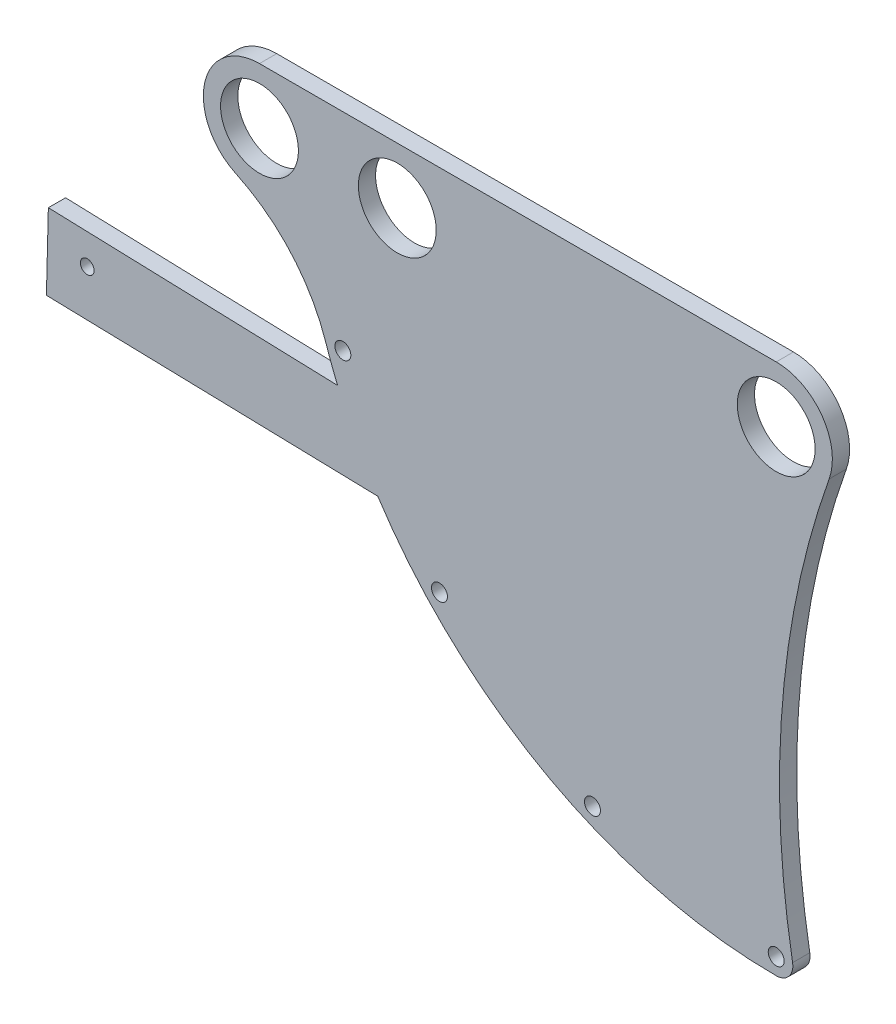
from build123d import *

# Parameters (mm, degrees)
SKETCH1_W           = 342.9
SKETCH1_H           = 225.424999902
SKETCH1_R           = 14.351
SKETCH1_R_2         = 2.9464
BOSS_EXTRUDE1_DEPTH = 6.35
SKETCH3_W           = 82.55
SKETCH3_H           = 25.4
SKETCH3_W_2         = 107.95
BOSS_EXTRUDE2_DEPTH = 6.35
SKETCH2_W           = 349.25
SKETCH2_H           = 250.824999902
CUT_EXTRUDE1_DEPTH  = 425.892825399
SKETCH4_R           = 2.54
BOSS_EXTRUDE3_DEPTH = 6.35


with BuildPart() as part:
    # Sketch1 → Boss-Extrude1 (new body)
    with BuildSketch(Plane.XY):
        with Locations((171.45, 112.712499951)):
            Rectangle(SKETCH1_W, SKETCH1_H)
        with Locations((254, 190.196999902)):
            Circle(SKETCH1_R, mode=Mode.SUBTRACT)
        with Locations((254, 21.032999902)):
            Circle(SKETCH1_R_2, mode=Mode.SUBTRACT)
        with Locations((186.255842738, 35.189941827)):
            Circle(SKETCH1_R_2, mode=Mode.SUBTRACT)
        with Locations((129.850387567, 75.291244482)):
            Circle(SKETCH1_R_2, mode=Mode.SUBTRACT)
        with Locations((63.5, 190.196999902)):
            Circle(SKETCH1_R, mode=Mode.SUBTRACT)
        with Locations((94.224517333, 134.624938265)):
            Circle(SKETCH1_R_2, mode=Mode.SUBTRACT)
        with Locations((114.3, 190.196999902)):
            Circle(SKETCH1_R, mode=Mode.SUBTRACT)
    extrude(amount=BOSS_EXTRUDE1_DEPTH)

    # Sketch3 → Boss-Extrude2 (add)
    with BuildSketch(Plane.XY.offset(6.35)):
        with Locations((41.275, 238.124999902)):
            Rectangle(SKETCH3_W, SKETCH3_H)
        with Locations((288.925, 238.124999902)):
            Rectangle(SKETCH3_W_2, SKETCH3_H)
    extrude(amount=-BOSS_EXTRUDE2_DEPTH)

    # Sketch2 → Cut-Extrude1 (cut, through all)
    with BuildSketch(Plane.XY.offset(6.35)):
        with Locations((174.625, 125.412499951)):
            Rectangle(SKETCH2_W, SKETCH2_H)
        with BuildLine():
            Line((63.5, 210.897999902), (254, 210.897999902))
            ThreePointArc((254, 210.897999902), (270.911602996, 202.135554467), (273.506313236, 183.266260769))
            ThreePointArc((273.506313236, 183.266260769), (256.315295195, 103.55517199), (260.028402179, 22.095969857))
            ThreePointArc((260.028402179, 22.095969857), (258.689264454, 17.098239828), (254, 14.911599902))
            ThreePointArc((254, 14.911599902), (151.729543137, 47.839263526), (87.882448428, 134.251217999))
            ThreePointArc((87.882448428, 134.251217999), (75.095322901, 156.248343931), (54.699389386, 171.459853539))
            ThreePointArc((54.699389386, 171.459853539), (43.295927788, 194.705532598), (63.5, 210.897999902))
        make_face(mode=Mode.SUBTRACT)
    extrude(amount=-CUT_EXTRUDE1_DEPTH, mode=Mode.SUBTRACT)

    # Sketch4 → Boss-Extrude3 (add, through all)
    with BuildSketch(Plane(origin=(0, 0, 0), x_dir=(-1, 0, 0), z_dir=(0, 0, -1))):
        with BuildLine():
            Line((14.341332207, 125.960529154), (-92.300756311, 122.533671254))
            ThreePointArc((-92.300756311, 122.533671254), (-99.071136292, 108.209082235), (-107.107329861, 94.554358196))
            Line((-107.107329861, 94.554358196), (15.054572396, 97.629850266))
            Line((15.054572396, 97.629850266), (14.341332207, 125.960529154))
        make_face()
        with Locations((0, 114.3)):
            Circle(SKETCH4_R, mode=Mode.SUBTRACT)
    extrude(amount=-BOSS_EXTRUDE3_DEPTH)


solid = part.part
